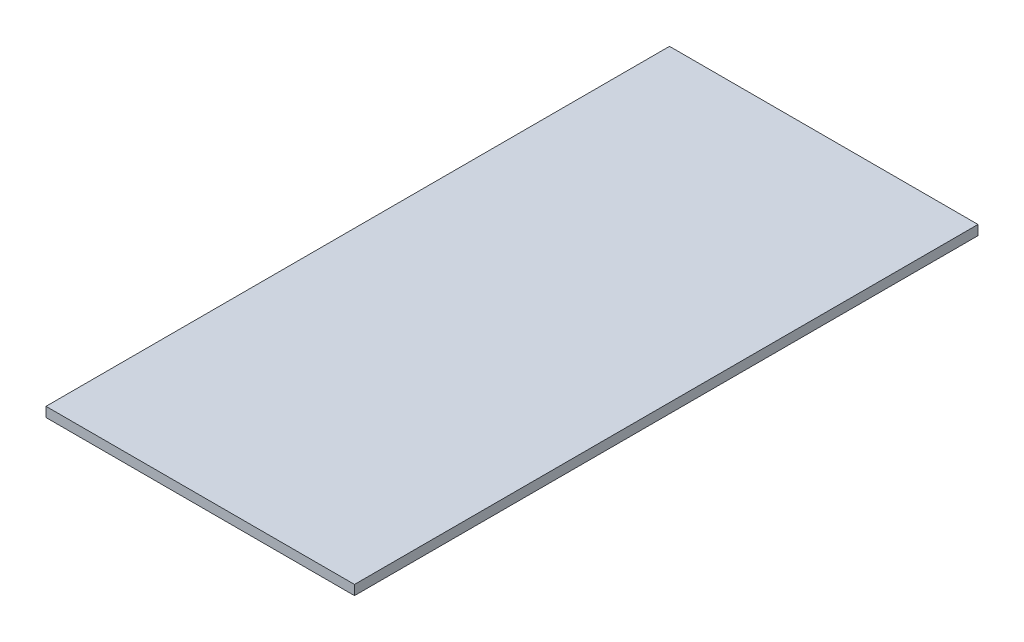
from build123d import *

# Parameters (mm, degrees)
SKETCH1_W           = 603.25
SKETCH1_H           = 1219.2
BOSS_EXTRUDE1_DEPTH = 19.05


with BuildPart() as part:
    # Sketch1 → Boss-Extrude1 (new body)
    with BuildSketch(Plane(origin=(0, 0, 0), x_dir=(1, 0, 0), z_dir=(0, 1, 0))):
        with Locations((301.625, 609.6)):
            Rectangle(SKETCH1_W, SKETCH1_H)
    extrude(amount=BOSS_EXTRUDE1_DEPTH)


solid = part.part
